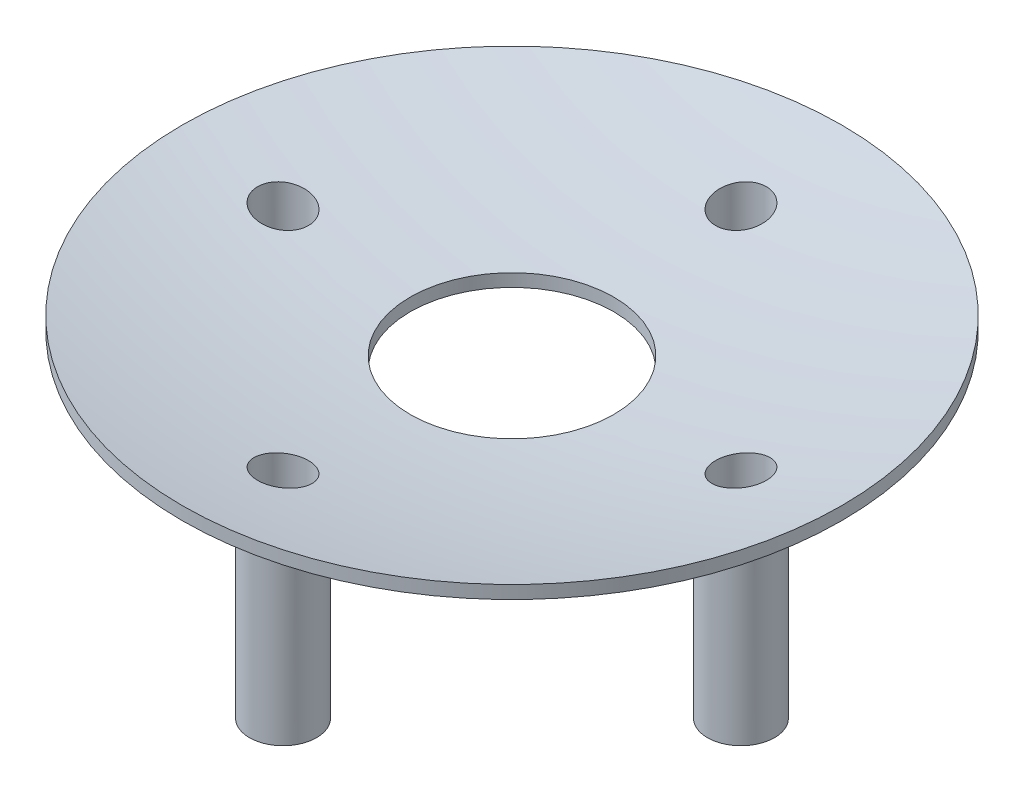
from build123d import *

# Parameters (mm, degrees)
BOSS_EXTRUDE2_REACH             = 105.962
BOSS_EXTRUDE2_END_RADIUS        = 179.3875
SKETCH2_R                       = 4.191
BOSS_EXTRUDE2_DIRECTION_2_DEPTH = 22.86
SKETCH2_6_R                     = 72.587717307
SKETCH2_6_R_2                   = 41.148
SKETCH2_6_R_3                   = 12.7
CUT_EXTRUDE3_DEPTH              = 106.169068821
CUT_EXTRUDE4_DEPTH              = 63.521159813
CUT_EXTRUDE4_DEPTH_BACK         = 63.521159813
SKETCH2_8_R                     = 3.175


with BuildPart() as part:
    # Sketch1 → Revolve1 (revolve)
    with BuildSketch(Plane.XY):
        with BuildLine():
            Line((0, 1.5875), (0, 0))
            ThreePointArc((0, 0), (-37.095674447, 3.877425948), (-72.587717307, 15.342084177))
            Line((-72.587717307, 15.342084177), (-71.138583931, 16.439220241))
            ThreePointArc((-71.138583931, 16.439220241), (-36.336179346, 5.340029261), (0, 1.5875))
        make_face()
    revolve(axis=Axis((0, 0, 0), (0, 1, 0)))

    # Boss-Extrude2: up to this sphere (the profile starts outside it)
    boss_extrude2_end = Location((0, 179.3875, 0)) * Sphere(BOSS_EXTRUDE2_END_RADIUS, mode=Mode.PRIVATE)
    # Sketch2 → Boss-Extrude2 (add, up to the surface)
    with BuildSketch(Plane(origin=(0, 0, 0), x_dir=(1, 0, 0), z_dir=(0, 1, 0)), mode=Mode.PRIVATE) as boss_extrude2_sk1:
        with Locations((0, -28.575)):
            Circle(SKETCH2_R)
    boss_extrude2_tool1 = extrude(boss_extrude2_sk1.sketch, amount=BOSS_EXTRUDE2_REACH, mode=Mode.PRIVATE) - boss_extrude2_end
    add(boss_extrude2_tool1.solids().sort_by_distance((0, 0, 28.575))[0])
    # Sketch2 → Boss-Extrude2 (add, up to the surface)
    with BuildSketch(Plane(origin=(0, 0, 0), x_dir=(1, 0, 0), z_dir=(0, 1, 0)), mode=Mode.PRIVATE) as boss_extrude2_sk2:
        with Locations((28.575, 0)):
            Circle(SKETCH2_R)
    boss_extrude2_tool2 = extrude(boss_extrude2_sk2.sketch, amount=BOSS_EXTRUDE2_REACH, mode=Mode.PRIVATE) - boss_extrude2_end
    add(boss_extrude2_tool2.solids().sort_by_distance((28.575, 0, 0))[0])
    # Sketch2 → Boss-Extrude2 (add, up to the surface)
    with BuildSketch(Plane(origin=(0, 0, 0), x_dir=(1, 0, 0), z_dir=(0, 1, 0)), mode=Mode.PRIVATE) as boss_extrude2_sk3:
        with Locations((0, 28.575)):
            Circle(SKETCH2_R)
    boss_extrude2_tool3 = extrude(boss_extrude2_sk3.sketch, amount=BOSS_EXTRUDE2_REACH, mode=Mode.PRIVATE) - boss_extrude2_end
    add(boss_extrude2_tool3.solids().sort_by_distance((0, 0, -28.575))[0])
    # Sketch2 → Boss-Extrude2 (add, up to the surface)
    with BuildSketch(Plane(origin=(0, 0, 0), x_dir=(1, 0, 0), z_dir=(0, 1, 0)), mode=Mode.PRIVATE) as boss_extrude2_sk4:
        with Locations((-28.575, 0)):
            Circle(SKETCH2_R)
    boss_extrude2_tool4 = extrude(boss_extrude2_sk4.sketch, amount=BOSS_EXTRUDE2_REACH, mode=Mode.PRIVATE) - boss_extrude2_end
    add(boss_extrude2_tool4.solids().sort_by_distance((-28.575, 0, 0))[0])

    # Sketch2 → Boss-Extrude2 direction 2 (add)
    with BuildSketch(Plane(origin=(0, 0, 0), x_dir=(1, 0, 0), z_dir=(0, 1, 0))):
        with Locations((0, -28.575)):
            Circle(SKETCH2_R)
        with Locations((28.575, 0)):
            Circle(SKETCH2_R)
        with Locations((0, 28.575)):
            Circle(SKETCH2_R)
        with Locations((-28.575, 0)):
            Circle(SKETCH2_R)
    extrude(amount=-BOSS_EXTRUDE2_DIRECTION_2_DEPTH)

    # Sketch2<6> → Cut-Extrude3 (cut, through all)
    # profile 1 of 2: a face of its own
    with BuildSketch(Plane(origin=(0, 0, 0), x_dir=(1, 0, 0), z_dir=(0, 1, 0))):
        Circle(SKETCH2_6_R)
        Circle(SKETCH2_6_R_2, mode=Mode.SUBTRACT)
    # profile 2 of 2: a face of its own
    with BuildSketch(Plane(origin=(0, 0, 0), x_dir=(1, 0, 0), z_dir=(0, 1, 0))):
        Circle(SKETCH2_6_R_3)
    extrude(amount=CUT_EXTRUDE3_DEPTH, mode=Mode.SUBTRACT)


with BuildPart() as cut_extrude3_kept_piece:
    # of the separate pieces the step leaves, the one the design keeps (cut_extrude3_pieces_kept)
    add(part.part.solids().sort_by_distance((41.148, 6.414432455, 0))[0])

    # Sketch2<8> → Cut-Extrude4 (cut, two sides: drawn at the far end of the back side and taken through both)
    with BuildSketch(Plane(origin=(0, 0, 0), x_dir=(1, 0, 0), z_dir=(0, 1, 0)).offset(-CUT_EXTRUDE4_DEPTH_BACK)):
        with Locations((0, -28.575)):
            Circle(SKETCH2_8_R)
        with Locations((28.575, 0)):
            Circle(SKETCH2_8_R)
        with Locations((0, 28.575)):
            Circle(SKETCH2_8_R)
        with Locations((-28.575, 0)):
            Circle(SKETCH2_8_R)
    extrude(amount=CUT_EXTRUDE4_DEPTH + CUT_EXTRUDE4_DEPTH_BACK, mode=Mode.SUBTRACT)


solid = cut_extrude3_kept_piece.part
